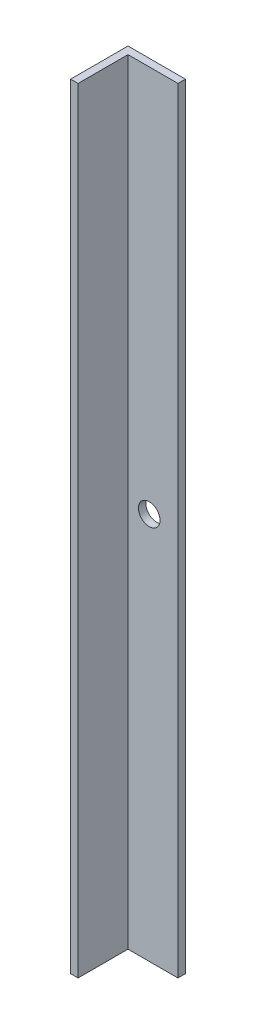
from build123d import *

# Parameters (mm, degrees)
BOSS_EXTRUDE1_DEPTH = 342.9
CUT_EXTRUDE1_REACH  = 346.776
SKETCH2_R           = 4.7625


with BuildPart() as part:
    # Sketch1 → Boss-Extrude1 (new body)
    with BuildSketch(Plane(origin=(0, 0, 0), x_dir=(1, 0, 0), z_dir=(0, 1, 0))):
        Polygon((0, 0), (3.302, 0), (3.302, 22.098), (25.4, 22.098), (25.4, 25.4), (0, 25.4), align=None)
    extrude(amount=BOSS_EXTRUDE1_DEPTH)

    # Sketch2 → Cut-Extrude1 (cut, up to next)
    with BuildSketch(Plane(origin=(0, 0, -25.4), x_dir=(-1, 0, 0), z_dir=(0, 0, -1)), mode=Mode.PRIVATE) as cut_extrude1_sk1:
        with Locations((-12.7, 171.45)):
            Circle(SKETCH2_R)
    cut_extrude1_tool1 = extrude(cut_extrude1_sk1.sketch, amount=-CUT_EXTRUDE1_REACH, mode=Mode.PRIVATE) & part.part
    add(cut_extrude1_tool1.solids().sort_by_distance((12.7, 171.45, -25.4))[0], mode=Mode.SUBTRACT)


solid = part.part
